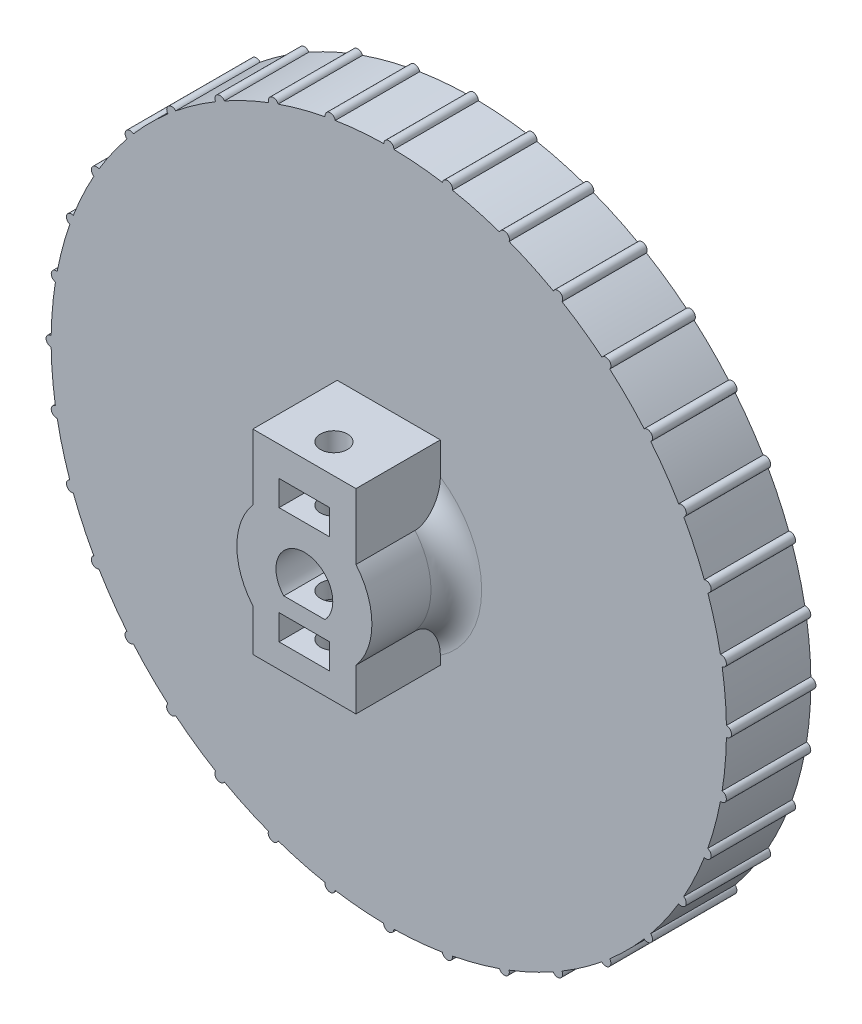
from build123d import *

# Parameters (mm, degrees)
IZIM1_R                     = 8
Y_KSEKLIK_EKSTR_ZYON1_DEPTH = 8
IZIM3_W                     = 6
IZIM3_H                     = 3
KES_EKSTR_ZYON1_DEPTH       = 7
Y_KSEKLIK_EKSTR_ZYON2_START = 2
IZIM4_R                     = 8
Y_KSEKLIK_EKSTR_ZYON2_DEPTH = 2
KES_EKSTR_ZYON2_DEPTH       = 7
KES_EKSTR_ZYON2_DEPTH_BACK  = 2
IZIM5_R                     = 1.6
IZIM6_R                     = 40
Y_KSEKLIK_EKSTR_ZYON3_DEPTH = 10
RADYUS1_R                   = 3
Y_KSEKLIK_EKSTR_ZYON4_DEPTH = 10
DAIRESEL_KAPLAMA1_COUNT     = 36
KES_EKSTR_ZYON3_START       = -19
KES_EKSTR_ZYON3_DEPTH       = 19
Y_KSEKLIK_EKSTR_ZYON5_REACH = 62.796
KES_EKSTR_ZYON4_START       = -19
IZIM12_R                    = 1.6
KES_EKSTR_ZYON4_DEPTH       = 19
KES_EKSTR_ZYON5_DEPTH       = 72
IZIM14_W                    = 12.218687808
IZIM14_H                    = 7.791703015
Y_KSEKLIK_EKSTR_ZYON6_DEPTH = 14
IZIM15_W                    = 6
IZIM15_H                    = 3
KES_EKSTR_ZYON6_DEPTH       = 7
IZIM16_R                    = 1.6
KES_EKSTR_ZYON7_DEPTH       = 40


with BuildPart() as part:
    # Çizim1 → Yükseklik-Ekstrüzyon1 (new body)
    with BuildSketch(Plane.XY):
        Circle(IZIM1_R)
        with BuildLine():
            Line((-1.9, -2.321637353), (1.9, -2.321637353))
            ThreePointArc((1.9, -2.321637353), (0, 3), (-1.9, -2.321637353))
        make_face(mode=Mode.SUBTRACT)
    extrude(amount=Y_KSEKLIK_EKSTR_ZYON1_DEPTH)

    # Çizim3 → Kes-Ekstrüzyon1 (cut)
    with BuildSketch(Plane.XY.offset(8)):
        with Locations((0, -5.821637353)):
            Rectangle(IZIM3_W, IZIM3_H)
    extrude(amount=-KES_EKSTR_ZYON1_DEPTH, mode=Mode.SUBTRACT)

    # Çizim4 → Yükseklik-Ekstrüzyon2 (add)
    with BuildSketch(Plane(origin=(0, 0, 0), x_dir=(-1, 0, 0), z_dir=(0, 0, -1)).offset(Y_KSEKLIK_EKSTR_ZYON2_START)):
        Circle(IZIM4_R)
        with BuildLine():
            Line((1.9, -2.321637353), (-1.9, -2.321637353))
            ThreePointArc((-1.9, -2.321637353), (0, 3), (1.9, -2.321637353))
        make_face(mode=Mode.SUBTRACT)
    extrude(amount=-Y_KSEKLIK_EKSTR_ZYON2_DEPTH)

    # Çizim5 → Kes-Ekstrüzyon2 (cut, two sides: drawn at the far end of the back side and taken through both)
    with BuildSketch(Plane.XZ.offset(4.321637353).offset(-KES_EKSTR_ZYON2_DEPTH_BACK)):
        with Locations(Location((0, 4.5, 0), (0, 0, 90))):
            Circle(IZIM5_R)
    extrude(amount=KES_EKSTR_ZYON2_DEPTH + KES_EKSTR_ZYON2_DEPTH_BACK, mode=Mode.SUBTRACT)

    # Çizim6 → Yükseklik-Ekstrüzyon3 (add)
    with BuildSketch(Plane(origin=(0, 0, -2), x_dir=(-1, 0, 0), z_dir=(0, 0, -1))):
        Circle(IZIM6_R)
    extrude(amount=Y_KSEKLIK_EKSTR_ZYON3_DEPTH)

    # Radyus1
    radyus1_edges = [part.edges().sort_by_distance(p)[0] for p in [
        (8, 0, -2),
    ]]
    fillet(radyus1_edges, radius=RADYUS1_R)

    # Çizim9 → Yükseklik-Ekstrüzyon4 (add)
    with BuildSketch(Plane.XY.offset(-2)):
        with BuildLine():
            ThreePointArc((-0.594905869, 39.995575843), (0.006331676, 39.999999499), (0.60756779, 39.995385501))
            ThreePointArc((0.60756779, 39.995385501), (0.006426131, 40.596717501), (-0.594905869, 39.995575843))
        make_face()
    y_kseklik_ekstr_zyon4 = extrude(amount=-Y_KSEKLIK_EKSTR_ZYON4_DEPTH)

    # Dairesel Kaplama1: Yükseklik-Ekstrüzyon4 ×36 about axis
    dairesel_kaplama1_axis = Axis((0, 0, 0), (0, 0, 1))
    for i in range(1, DAIRESEL_KAPLAMA1_COUNT):
        add(y_kseklik_ekstr_zyon4.rotate(dairesel_kaplama1_axis, i * 360 / DAIRESEL_KAPLAMA1_COUNT))

    # Çizim10 → Kes-Ekstrüzyon3 (cut)
    with BuildSketch(Plane.XY.offset(-2).offset(KES_EKSTR_ZYON3_START)):
        with BuildLine():
            Line((-1.9, -2.321637353), (1.9, -2.321637353))
            ThreePointArc((1.9, -2.321637353), (0, 3), (-1.9, -2.321637353))
        make_face()
    extrude(amount=KES_EKSTR_ZYON3_DEPTH, mode=Mode.SUBTRACT)

    # Yükseklik-Ekstrüzyon5: up to this face of the body (flat: up to its plane)
    y_kseklik_ekstr_zyon5_end = Plane(part.part.faces().sort_by_distance((-12.148248573, 0, -2))[0])
    # Çizim11 → Yükseklik-Ekstrüzyon5 (add, up to the picked face)
    with BuildSketch(Plane.XY.offset(8), mode=Mode.PRIVATE) as y_kseklik_ekstr_zyon5_sk1:
        Polygon((-3, -5.164873382), (-6.109343904, -5.164873382), (-6.109343904, -10.164873382), (6.109343904, -10.164873382), (6.109343904, -5.164873382), (3, -5.164873382), (3, -7.321637353), (-3, -7.321637353), align=None)
    y_kseklik_ekstr_zyon5_tool1 = split(extrude(y_kseklik_ekstr_zyon5_sk1.sketch, amount=-Y_KSEKLIK_EKSTR_ZYON5_REACH, mode=Mode.PRIVATE), bisect_by=y_kseklik_ekstr_zyon5_end, keep=Keep.BOTH, mode=Mode.PRIVATE)
    add(y_kseklik_ekstr_zyon5_tool1.solids().sort_by(Axis((0, -8.046919, 8), (0, 0, -1)))[0])

    # Çizim12 → Kes-Ekstrüzyon4 (cut)
    with BuildSketch(Plane(origin=(0, -2.321637353, 0), x_dir=(1, 0, 0), z_dir=(0, 1, 0)).offset(KES_EKSTR_ZYON4_START)):
        with Locations(Location((0, -4.5, 0), (0, 0, 270))):
            Circle(IZIM12_R)
    extrude(amount=KES_EKSTR_ZYON4_DEPTH, mode=Mode.SUBTRACT)

    # Çizim13 → Kes-Ekstrüzyon5 (cut)
    with BuildSketch(Plane.XY.offset(8)):
        with BuildLine():
            Line((2.436896564, -2.321637353), (-2.436896564, -2.321637353))
            ThreePointArc((-2.436896564, -2.321637353), (0, 3.365778493), (2.436896564, -2.321637353))
        make_face()
    extrude(amount=-KES_EKSTR_ZYON5_DEPTH, mode=Mode.SUBTRACT)

    # Çizim14 → Yükseklik-Ekstrüzyon6 (add)
    with BuildSketch(Plane.XY.offset(8)):
        with Locations((0, 9.06072489)):
            Rectangle(IZIM14_W, IZIM14_H)
    extrude(amount=-Y_KSEKLIK_EKSTR_ZYON6_DEPTH)

    # Çizim15 → Kes-Ekstrüzyon6 (cut)
    with BuildSketch(Plane.XY.offset(8)):
        with Locations((0, 7.944837865)):
            Rectangle(IZIM15_W, IZIM15_H)
    extrude(amount=-KES_EKSTR_ZYON6_DEPTH, mode=Mode.SUBTRACT)

    # Çizim16 → Kes-Ekstrüzyon7 (cut)
    with BuildSketch(Plane.XZ.offset(10.164873382)):
        with Locations(Location((0, 4.5, 0), (0, 0, 90))):
            Circle(IZIM16_R)
    extrude(amount=-KES_EKSTR_ZYON7_DEPTH, mode=Mode.SUBTRACT)


solid = part.part
